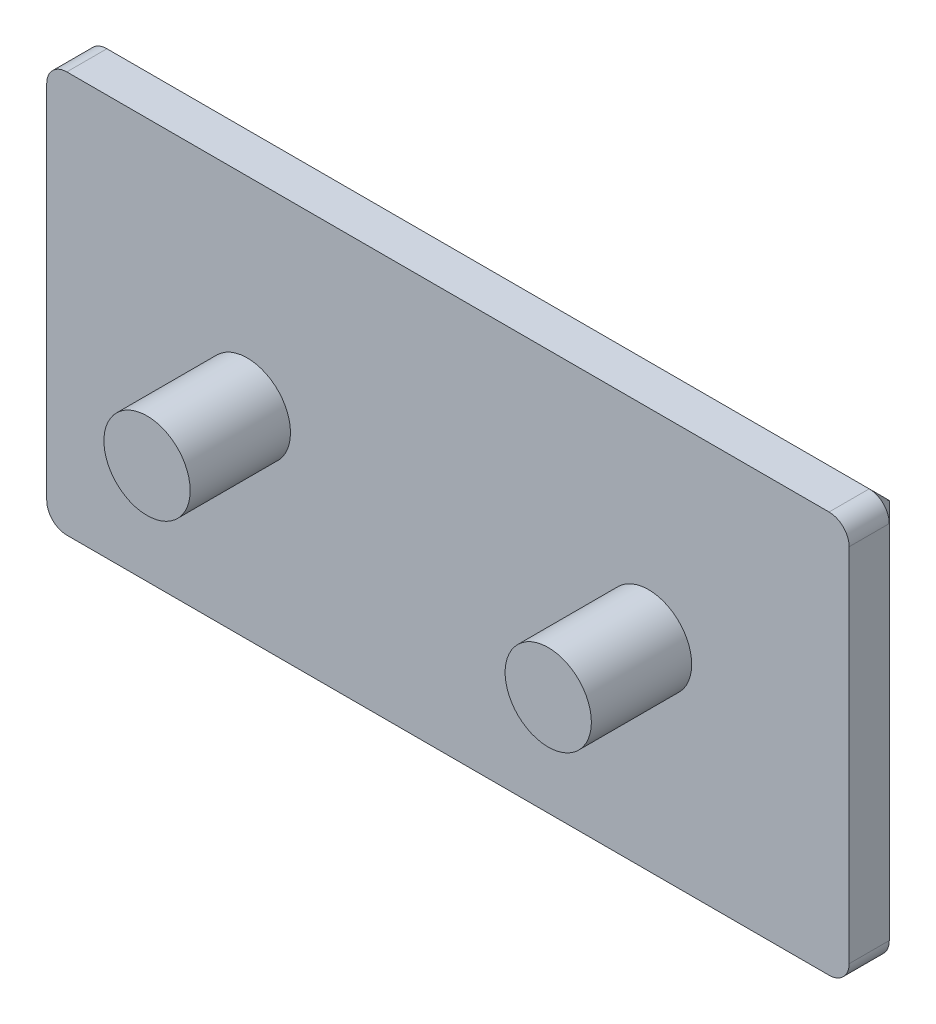
from build123d import *

# Parameters (mm, degrees)
SKETCH1_W           = 40
SKETCH1_H           = 20
BOSS_EXTRUDE1_DEPTH = 3
SKETCH2_R           = 2.15
BOSS_EXTRUDE2_DEPTH = 5
FILLET1_R           = 1
CHAMFER1_SIZE       = 1


with BuildPart() as part:
    # Sketch1 → Boss-Extrude1 (new body)
    with BuildSketch(Plane.XY):
        Rectangle(SKETCH1_W, SKETCH1_H)
    extrude(amount=BOSS_EXTRUDE1_DEPTH)

    # Sketch2 → Boss-Extrude2 (add)
    with BuildSketch(Plane.XY.offset(3)):
        with Locations((10, 0)):
            Circle(SKETCH2_R)
        with Locations((-10, 0)):
            Circle(SKETCH2_R)
    extrude(amount=BOSS_EXTRUDE2_DEPTH)

    # Fillet1
    fillet1_edges = [part.edges().sort_by_distance(p)[0] for p in [
        (20, -10, 1.5),
        (-20, -10, 1.5),
        (-20, 10, 1.5),
        (20, 10, 1.5),
    ]]
    fillet(fillet1_edges, radius=FILLET1_R)

    # Chamfer1
    chamfer1_edges = [part.edges().sort_by_distance(p)[0] for p in [
        (20, 0, 0),
        (0, -10, 0),
        (-20, 0, 0),
        (0, 10, 0),
        (-19.707106781, 9.707106781, 0),
        (19.707106781, 9.707106781, 0),
        (-19.707106781, -9.707106781, 0),
        (19.707106781, -9.707106781, 0),
    ]]
    chamfer(chamfer1_edges, length=CHAMFER1_SIZE)


solid = part.part
